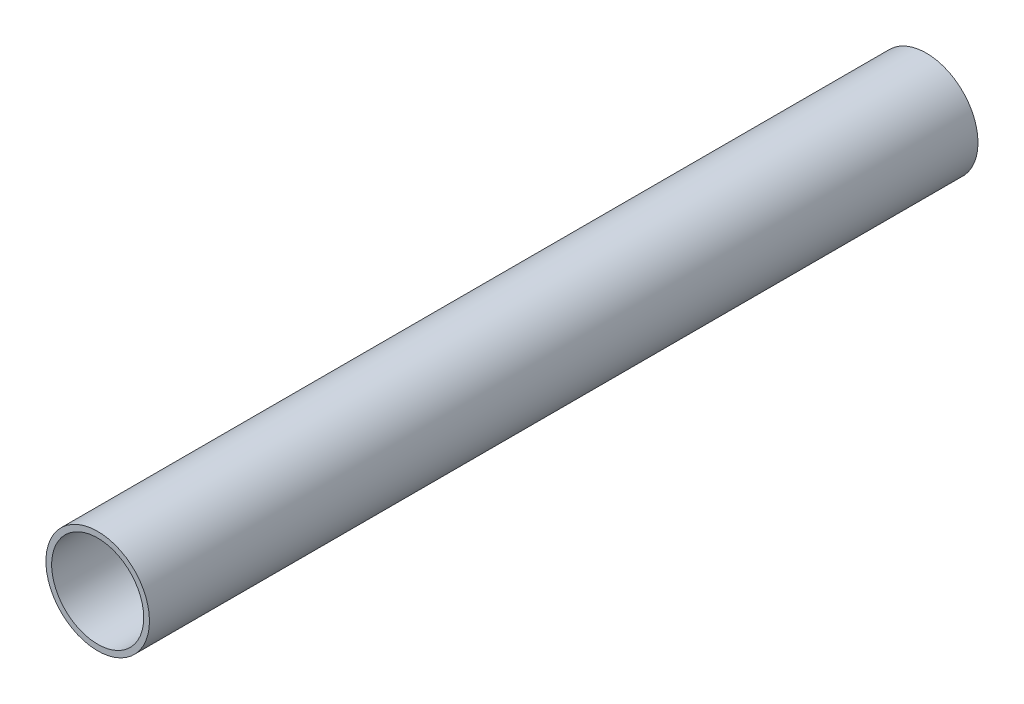
from build123d import *

# Parameters (mm, degrees)
SKETCH1_R           = 14.2875
SKETCH1_R_2         = 12.7
BOSS_EXTRUDE1_DEPTH = 228.6


with BuildPart() as part:
    # Sketch1 → Boss-Extrude1 (new body)
    with BuildSketch(Plane.XY):
        Circle(SKETCH1_R)
        Circle(SKETCH1_R_2, mode=Mode.SUBTRACT)
    extrude(amount=BOSS_EXTRUDE1_DEPTH)


solid = part.part
